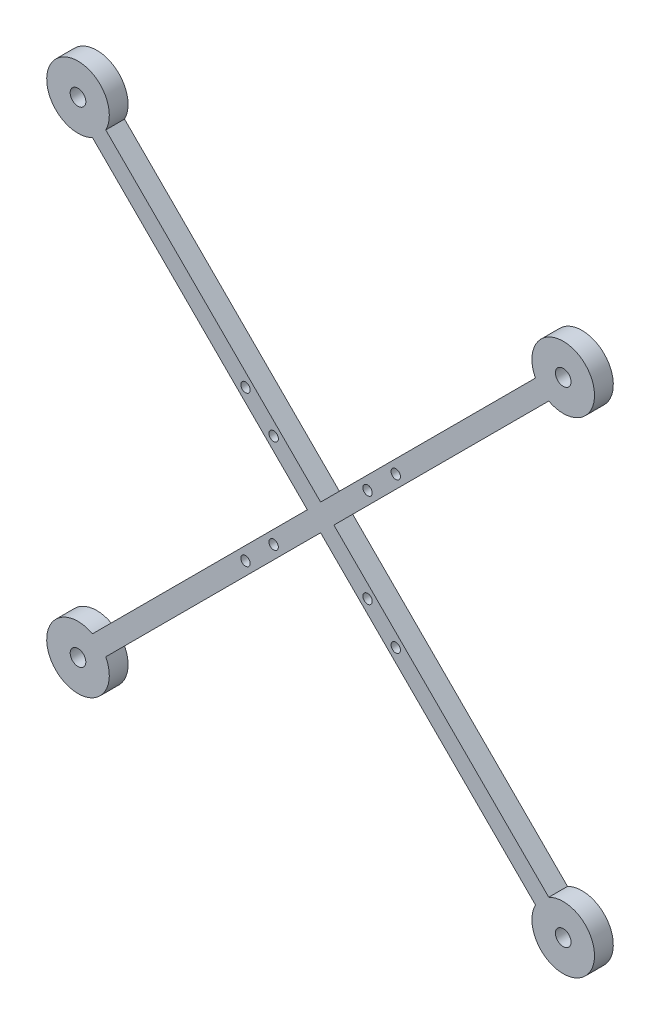
from build123d import *

# Parameters (mm, degrees)
SKETCH1_R           = 2.5
SKETCH1_R_2         = 1.5
BOSS_EXTRUDE1_DEPTH = 6


with BuildPart() as part:
    # Sketch1 → Boss-Extrude1 (new body)
    with BuildSketch(Plane.XY):
        with BuildLine():
            Line((-72.875951562, -68.633310875), (-4.242640687, 0))
            Line((-4.242640687, 0), (-72.875951562, 68.633310875))
            ThreePointArc((-72.875951562, 68.633310875), (-84.571067812, 84.571067812), (-68.633310875, 72.875951562))
            Line((-68.633310875, 72.875951562), (0, 4.242640687))
            Line((0, 4.242640687), (68.633310875, 72.875951562))
            ThreePointArc((68.633310875, 72.875951562), (84.571067812, 84.571067812), (72.875951562, 68.633310875))
            Line((72.875951562, 68.633310875), (4.242640687, 0))
            Line((4.242640687, 0), (72.875951562, -68.633310875))
            ThreePointArc((72.875951562, -68.633310875), (84.571067812, -84.571067812), (68.633310875, -72.875951562))
            Line((68.633310875, -72.875951562), (0, -4.242640687))
            Line((0, -4.242640687), (-68.633310875, -72.875951562))
            ThreePointArc((-68.633310875, -72.875951562), (-84.571067812, -84.571067812), (-72.875951562, -68.633310875))
        make_face()
        with Locations((-77.5, -77.5)):
            Circle(SKETCH1_R, mode=Mode.SUBTRACT)
        with Locations((-15, -15)):
            Circle(SKETCH1_R_2, mode=Mode.SUBTRACT)
        with Locations((-24, -24)):
            Circle(SKETCH1_R_2, mode=Mode.SUBTRACT)
        with Locations((-24, 24)):
            Circle(SKETCH1_R_2, mode=Mode.SUBTRACT)
        with Locations((-15, 15)):
            Circle(SKETCH1_R_2, mode=Mode.SUBTRACT)
        with Locations((-77.5, 77.5)):
            Circle(SKETCH1_R, mode=Mode.SUBTRACT)
        with Locations((24, 24)):
            Circle(SKETCH1_R_2, mode=Mode.SUBTRACT)
        with Locations((15, 15)):
            Circle(SKETCH1_R_2, mode=Mode.SUBTRACT)
        with Locations((77.5, 77.5)):
            Circle(SKETCH1_R, mode=Mode.SUBTRACT)
        with Locations((24, -24)):
            Circle(SKETCH1_R_2, mode=Mode.SUBTRACT)
        with Locations((15, -15)):
            Circle(SKETCH1_R_2, mode=Mode.SUBTRACT)
        with Locations((77.5, -77.5)):
            Circle(SKETCH1_R, mode=Mode.SUBTRACT)
    extrude(amount=BOSS_EXTRUDE1_DEPTH)


solid = part.part
